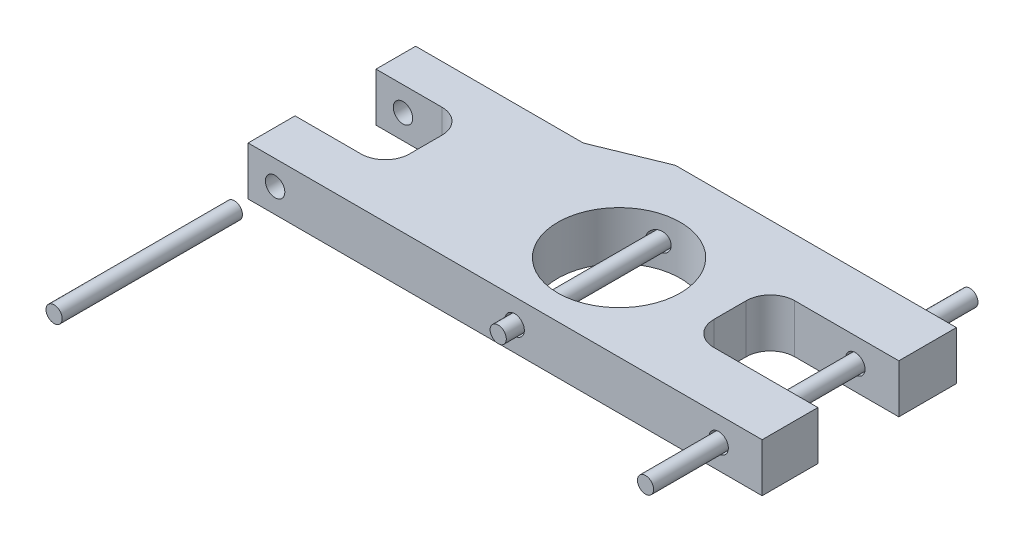
from build123d import *

# Parameters (mm, degrees)
SKETCH21_R         = 9.618966791
EXTRUDE1_DEPTH     = 3.81
SKETCH22_R         = 1.524
CUT_EXTRUDE1_DEPTH = 91.7575
EXTRUDE2_START     = -3.81
SKETCH24_R         = 1.27
EXTRUDE2_DEPTH     = 34.29
SKETCH24_3_R       = 1.27
EXTRUDE3_DEPTH     = 28.288
EXTRUDE4_START     = 5.08
SKETCH24_4_R       = 1.27
EXTRUDE4_DEPTH     = 50.894


with BuildPart() as part:
    # Sketch21 → Extrude1 (new, symmetric)
    with BuildSketch(Plane(origin=(0, 0, 0), x_dir=(1, 0, 0), z_dir=(0, 1, 0))):
        with BuildLine():
            Line((-68.34927062, 26.453430618), (-58.004863859, 26.453430618))
            ThreePointArc((-58.004863859, 26.453430618), (-55.310787023, 25.337507455), (-54.194863859, 22.643430618))
            Line((-54.194863859, 22.643430618), (-54.194863859, 17.563430618))
            ThreePointArc((-54.194863859, 17.563430618), (-55.310787023, 14.869353782), (-58.004863859, 13.753430618))
            Line((-58.004863859, 13.753430618), (-68.34927062, 13.753430618))
            Line((-68.34927062, 13.753430618), (-68.34927062, 6.389220304))
            Line((-68.34927062, 6.389220304), (12.303763798, 6.389220304))
            Line((12.303763798, 6.389220304), (12.303763798, 15.133953501))
            Line((12.303763798, 15.133953501), (-4.02424507, 15.133953501))
            ThreePointArc((-4.02424507, 15.133953501), (-6.718321906, 16.249876665), (-7.83424507, 18.943953501))
            Line((-7.83424507, 18.943953501), (-7.83424507, 24.023953501))
            ThreePointArc((-7.83424507, 24.023953501), (-6.718321906, 26.718030338), (-4.02424507, 27.833953501))
            Line((-4.02424507, 27.833953501), (12.303763798, 27.833953501))
            Line((12.303763798, 27.833953501), (12.303763798, 36.872358218))
            Line((12.303763798, 36.872358218), (-31.792837082, 36.872358218))
            Line((-31.792837082, 36.872358218), (-42.039547436, 32.676430618))
            Line((-42.039547436, 32.676430618), (-68.34927062, 32.676430618))
            Line((-68.34927062, 32.676430618), (-68.34927062, 26.453430618))
        make_face()
        with Locations((-23.6637447, 19.907505249)):
            Circle(SKETCH21_R, mode=Mode.SUBTRACT)
    extrude(amount=EXTRUDE1_DEPTH, both=True)

    # Sketch22 → Cut-Extrude1 (cut, symmetric)
    with BuildSketch(Plane(origin=(0, 0, -36.872358218), x_dir=(-1, 0, 0), z_dir=(0, 0, -1))):
        with Locations((-5.47919097, 0)):
            Circle(SKETCH22_R)
        with Locations((64.11680903, 0)):
            Circle(SKETCH22_R)
        with Locations((26.528431516, 0)):
            Circle(SKETCH22_R)
    extrude(amount=CUT_EXTRUDE1_DEPTH, both=True, mode=Mode.SUBTRACT)


with BuildPart() as body_2:
    # Sketch24 → Extrude2 (new body)
    with BuildSketch(Plane.XY.offset(EXTRUDE2_START)):
        with Locations((-26.528431516, 0)):
            Circle(SKETCH24_R)
    extrude(amount=-EXTRUDE2_DEPTH)


with BuildPart() as body_3:
    # Sketch24<3> → Extrude3 (new body)
    with BuildSketch(Plane.XY):
        with Locations((-64.11680903, 0)):
            Circle(SKETCH24_3_R)
    extrude(amount=EXTRUDE3_DEPTH)


with BuildPart() as body_4:
    # Sketch24<4> → Extrude4 (new body)
    with BuildSketch(Plane.XY.offset(EXTRUDE4_START)):
        with Locations((5.47919097, 0)):
            Circle(SKETCH24_4_R)
    extrude(amount=-EXTRUDE4_DEPTH)


solid = Compound([part.part, body_2.part, body_3.part, body_4.part])
